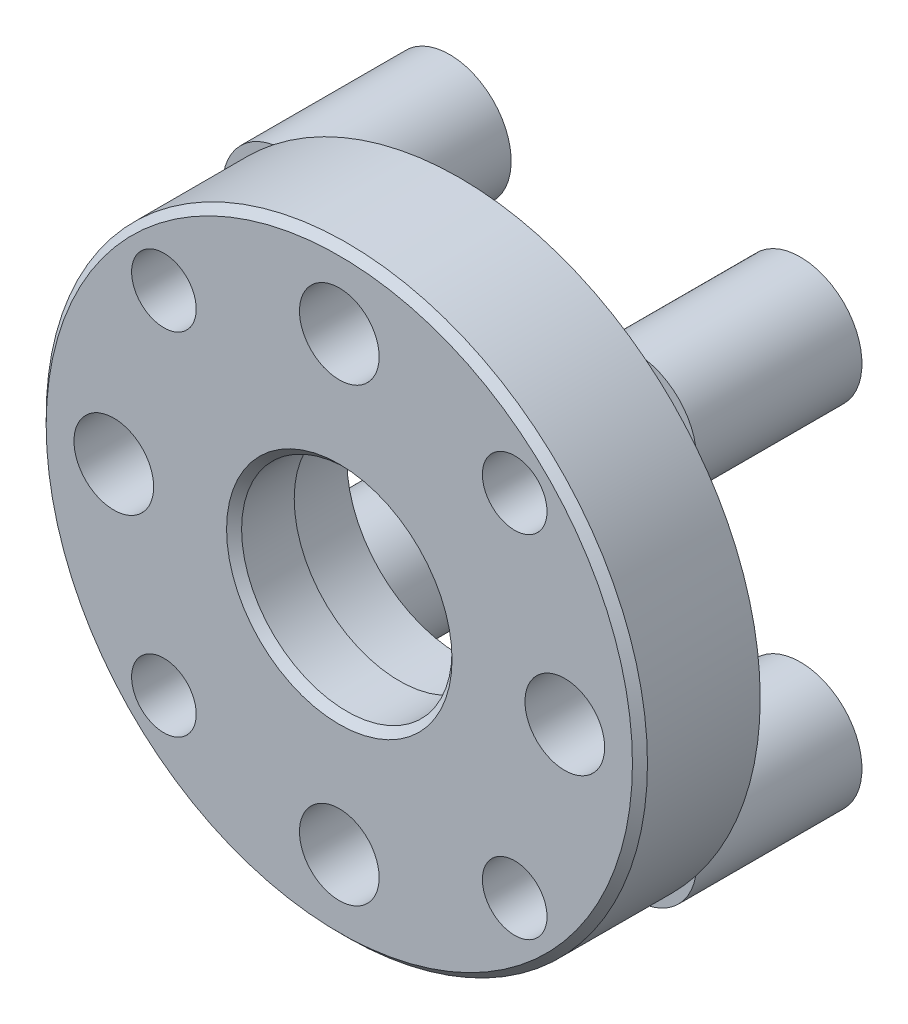
from build123d import *

# Parameters (mm, degrees)
SKETCH3_R             = 4
BOSS_EXTRUDE1_DEPTH   = 11
BOSS_EXTRUDE1_2_DEPTH = 11
BOSS_EXTRUDE1_3_DEPTH = 11
BOSS_EXTRUDE1_4_DEPTH = 11
SKETCH6_R             = 7.5
BOSS_EXTRUDE6_DEPTH   = 8
SKETCH8_R             = 1.6
CUT_EXTRUDE1_DEPTH    = 35.073450075
SKETCH9_R             = 3
CUT_EXTRUDE2_DEPTH    = 3
BOSS_EXTRUDE8_START   = -11
SKETCH10_R            = 4.1
SKETCH10_R_2          = 4
BOSS_EXTRUDE8_DEPTH   = 11
SKETCH11_R            = 2.65
SKETCH11_R_2          = 2.15
CUT_EXTRUDE3_DEPTH    = 8
BOSS_EXTRUDE9_START   = -4
SKETCH12_R            = 7.5
SKETCH12_R_2          = 7
BOSS_EXTRUDE9_DEPTH   = 4
CHAMFER1_SIZE         = 0.5


with BuildPart() as part:
    # Sketch3 → Boss-Extrude1 (new body)
    with BuildSketch(Plane(origin=(0, 0, 25.23473679), x_dir=(-1, 0, 0), z_dir=(0, 0, -1))):
        with Locations((-11.66726189, 11.66726189)):
            Circle(SKETCH3_R)
    extrude(amount=BOSS_EXTRUDE1_DEPTH)



with BuildPart() as body_2:
    # Sketch3 → Boss-Extrude1 2 (new body)
    with BuildSketch(Plane(origin=(0, 0, 25.23473679), x_dir=(-1, 0, 0), z_dir=(0, 0, -1))):
        with Locations((11.66726189, 11.66726189)):
            Circle(SKETCH3_R)
    extrude(amount=BOSS_EXTRUDE1_2_DEPTH)


with BuildPart() as body_3:
    # Sketch3 → Boss-Extrude1 3 (new body)
    with BuildSketch(Plane(origin=(0, 0, 25.23473679), x_dir=(-1, 0, 0), z_dir=(0, 0, -1))):
        with Locations((11.66726189, -11.66726189)):
            Circle(SKETCH3_R)
    extrude(amount=BOSS_EXTRUDE1_3_DEPTH)


with BuildPart() as body_4:
    # Sketch3 → Boss-Extrude1 4 (new body)
    with BuildSketch(Plane(origin=(0, 0, 25.23473679), x_dir=(-1, 0, 0), z_dir=(0, 0, -1))):
        with Locations((-11.66726189, -11.66726189)):
            Circle(SKETCH3_R)
    extrude(amount=BOSS_EXTRUDE1_4_DEPTH)


with BuildPart() as part_1:
    add(part.part)

    add(body_2.part)  # Boss-Extrude6 merges body 2

    add(body_3.part)  # Boss-Extrude6 merges body 3

    add(body_4.part)  # Boss-Extrude6 merges body 4
    # Sketch6 → Boss-Extrude6 (add)
    with BuildSketch(Plane.XY.offset(25.23473679)):
        with BuildLine():
            ThreePointArc((16.90822495, -10.682318524), (19.509460387, 4.402380652), (10.682318524, 16.90822495))
            ThreePointArc((10.682318524, 16.90822495), (-4.402380652, 19.509460387), (-16.90822495, 10.682318524))
            ThreePointArc((-16.90822495, 10.682318524), (-19.509460387, -4.402380652), (-10.682318524, -16.90822495))
            ThreePointArc((-10.682318524, -16.90822495), (4.402380652, -19.509460387), (16.90822495, -10.682318524))
        make_face()
        Circle(SKETCH6_R, mode=Mode.SUBTRACT)
    extrude(amount=BOSS_EXTRUDE6_DEPTH)

    # Sketch8 → Cut-Extrude1 (cut, through all)
    with BuildSketch(Plane.XY.offset(33.23473679)):
        with Locations((11.66726189, 11.66726189)):
            Circle(SKETCH8_R)
        with Locations((11.66726189, -11.66726189)):
            Circle(SKETCH8_R)
        with Locations((-11.66726189, -11.66726189)):
            Circle(SKETCH8_R)
        with Locations((-11.66726189, 11.66726189)):
            Circle(SKETCH8_R)
    extrude(amount=-CUT_EXTRUDE1_DEPTH, mode=Mode.SUBTRACT)

    # Sketch9 → Cut-Extrude2 (cut)
    with BuildSketch(Plane.XY.offset(14.23473679)):
        with Locations(Location((11.66726189, 11.66726189, 0), (0, 0, 180))):
            Circle(SKETCH9_R)
        with Locations(Location((11.66726189, -11.66726189, 0), (0, 0, 180))):
            Circle(SKETCH9_R)
        with Locations(Location((-11.66726189, -11.66726189, 0), (0, 0, 180))):
            Circle(SKETCH9_R)
        with Locations(Location((-11.66726189, 11.66726189, 0), (0, 0, 180))):
            Circle(SKETCH9_R)
    extrude(amount=CUT_EXTRUDE2_DEPTH, mode=Mode.SUBTRACT)

    # Sketch10 → Boss-Extrude8 (add)
    # profile 1 of 4: a face of its own
    with BuildSketch(Plane(origin=(0, 0, 14.23473679), x_dir=(-1, 0, 0), z_dir=(0, 0, -1)).offset(BOSS_EXTRUDE8_START)):
        with Locations((11.66726189, 11.66726189)):
            Circle(SKETCH10_R)
        with Locations((11.66726189, 11.66726189)):
            Circle(SKETCH10_R_2, mode=Mode.SUBTRACT)
    # profile 2 of 4: a face of its own
    with BuildSketch(Plane(origin=(0, 0, 14.23473679), x_dir=(-1, 0, 0), z_dir=(0, 0, -1)).offset(BOSS_EXTRUDE8_START)):
        with Locations((11.66726189, -11.66726189)):
            Circle(SKETCH10_R)
        with Locations((11.66726189, -11.66726189)):
            Circle(SKETCH10_R_2, mode=Mode.SUBTRACT)
    # profile 3 of 4: a face of its own
    with BuildSketch(Plane(origin=(0, 0, 14.23473679), x_dir=(-1, 0, 0), z_dir=(0, 0, -1)).offset(BOSS_EXTRUDE8_START)):
        with Locations((-11.66726189, -11.66726189)):
            Circle(SKETCH10_R)
        with Locations((-11.66726189, -11.66726189)):
            Circle(SKETCH10_R_2, mode=Mode.SUBTRACT)
    # profile 4 of 4: a face of its own
    with BuildSketch(Plane(origin=(0, 0, 14.23473679), x_dir=(-1, 0, 0), z_dir=(0, 0, -1)).offset(BOSS_EXTRUDE8_START)):
        with Locations((-11.66726189, 11.66726189)):
            Circle(SKETCH10_R)
        with Locations((-11.66726189, 11.66726189)):
            Circle(SKETCH10_R_2, mode=Mode.SUBTRACT)
    extrude(amount=BOSS_EXTRUDE8_DEPTH)

    # Sketch11 → Cut-Extrude3 (cut)
    with BuildSketch(Plane.XY.offset(33.23473679)):
        with Locations((0, 15)):
            Circle(SKETCH11_R)
        with Locations((15, 0)):
            Circle(SKETCH11_R)
        with Locations((0, -15)):
            Circle(SKETCH11_R)
        with Locations((-15, 0)):
            Circle(SKETCH11_R)
        with Locations((-11.66726189, 11.66726189)):
            Circle(SKETCH11_R_2)
        with Locations((11.66726189, 11.66726189)):
            Circle(SKETCH11_R_2)
        with Locations((11.66726189, -11.66726189)):
            Circle(SKETCH11_R_2)
        with Locations((-11.66726189, -11.66726189)):
            Circle(SKETCH11_R_2)
    extrude(amount=-CUT_EXTRUDE3_DEPTH, mode=Mode.SUBTRACT)

    # Sketch12 → Boss-Extrude9 (add)
    with BuildSketch(Plane.XY.offset(33.23473679).offset(BOSS_EXTRUDE9_START)):
        Circle(SKETCH12_R)
        Circle(SKETCH12_R_2, mode=Mode.SUBTRACT)
    extrude(amount=BOSS_EXTRUDE9_DEPTH)

    # Chamfer1
    chamfer1_edges = [part_1.edges().sort_by_distance(p)[0] for p in [
        (-16.90822495, 10.682318524, 33.23473679),
        (-7, 0, 33.23473679),
    ]]
    chamfer(chamfer1_edges, length=CHAMFER1_SIZE)


solid = part_1.part
